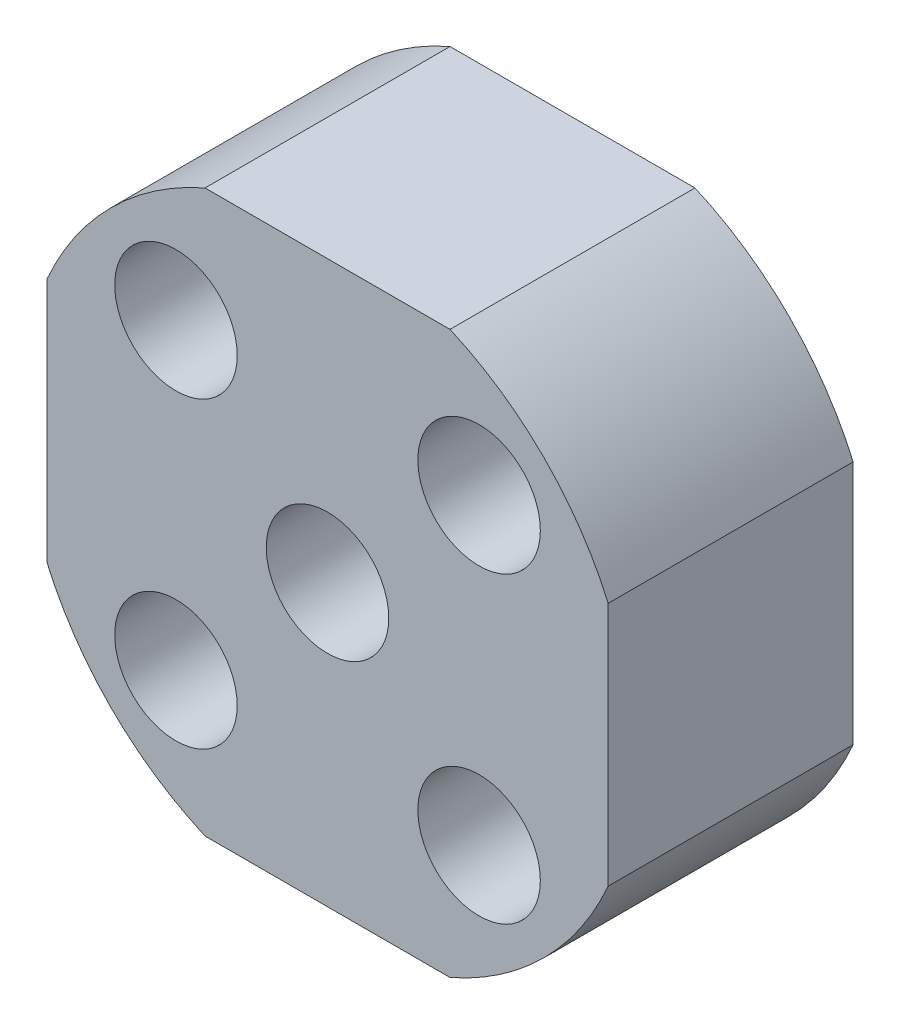
from build123d import *

# Parameters (mm, degrees)
SKETCH2_R           = 0.5
BOSS_EXTRUDE1_DEPTH = 2


with BuildPart() as part:
    # Sketch2 → Boss-Extrude1 (new body)
    with BuildSketch(Plane.XY):
        with BuildLine():
            Line((1, 2.291287847), (-1, 2.291287847))
            ThreePointArc((-1, 2.291287847), (-1.767766953, 1.767766953), (-2.291287847, 1))
            Line((-2.291287847, 1), (-2.291287847, -1))
            ThreePointArc((-2.291287847, -1), (-1.767766953, -1.767766953), (-1, -2.291287847))
            Line((-1, -2.291287847), (1, -2.291287847))
            ThreePointArc((1, -2.291287847), (1.767766953, -1.767766953), (2.291287847, -1))
            Line((2.291287847, -1), (2.291287847, 1))
            ThreePointArc((2.291287847, 1), (1.767766953, 1.767766953), (1, 2.291287847))
        make_face()
        Circle(SKETCH2_R, mode=Mode.SUBTRACT)
        with Locations((1.237436867, 1.237436867)):
            Circle(SKETCH2_R, mode=Mode.SUBTRACT)
        with Locations((1.237436867, -1.237436867)):
            Circle(SKETCH2_R, mode=Mode.SUBTRACT)
        with Locations((-1.237436867, -1.237436867)):
            Circle(SKETCH2_R, mode=Mode.SUBTRACT)
        with Locations((-1.237436867, 1.237436867)):
            Circle(SKETCH2_R, mode=Mode.SUBTRACT)
    extrude(amount=BOSS_EXTRUDE1_DEPTH)


solid = part.part
